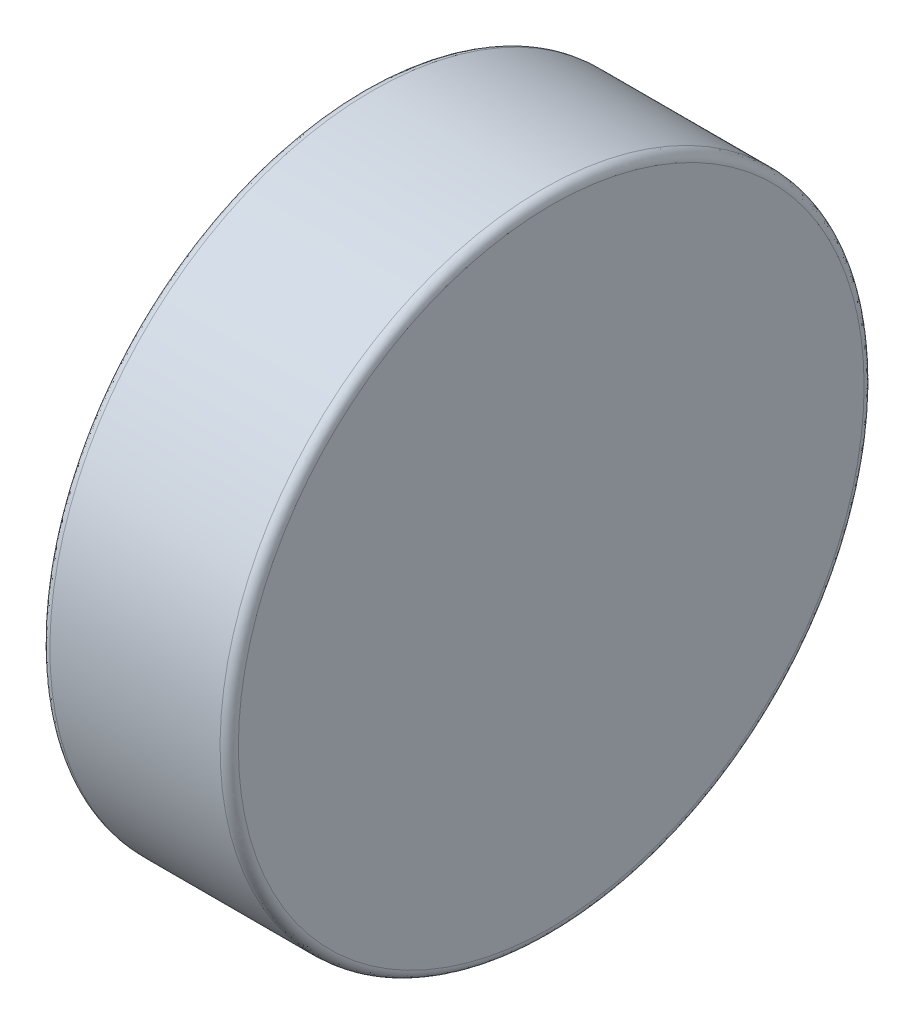
from build123d import *


with BuildPart() as part:
    # Sketch1 → Revolve1 (revolve)
    with BuildSketch(Plane.XY):
        with BuildLine():
            Line((-10.299999308, 34.2), (-10.299999308, 0))
            Line((-10.299999308, 0), (10.299999308, 0))
            Line((10.299999308, 0), (10.299999308, 34.2))
            add(Edge.make_bspline(
                [(9.3, 35.2), (9.496380937, 35.200115599), (9.692787626, 35.156130585), (9.877666121, 35.068037905), (10.039462243, 34.939461004), (10.168036936, 34.777666811), (10.256129773, 34.592788016), (10.300114951, 34.396381022), (10.299999308, 34.2)],
                knots=[2.2e-08, 2.2e-08, 2.2e-08, 2.2e-08, 2.2e-08, 2.2e-08, 2.2e-08, 2.2e-08, 2.2e-08, 1.571973388, 1.571973388, 1.571973388, 1.571973388, 1.571973388, 1.571973388, 1.571973388, 1.571973388, 1.571973388], degree=8))
            Line((9.3, 35.2), (-9.3, 35.2))
            add(Edge.make_bspline(
                [(-10.299999308, 34.2), (-10.300114951, 34.396381022), (-10.256129773, 34.592788016), (-10.168036936, 34.777666811), (-10.039462243, 34.939461004), (-9.877666121, 35.068037905), (-9.692787626, 35.156130585), (-9.496380937, 35.200115599), (-9.3, 35.2)],
                knots=[-1.571973388, -1.571973388, -1.571973388, -1.571973388, -1.571973388, -1.571973388, -1.571973388, -1.571973388, -1.571973388, -2.2e-08, -2.2e-08, -2.2e-08, -2.2e-08, -2.2e-08, -2.2e-08, -2.2e-08, -2.2e-08, -2.2e-08], degree=8))
        make_face()
    revolve(axis=Axis((-10.299999308, 0, 0), (1, 0, 0)))


solid = part.part
